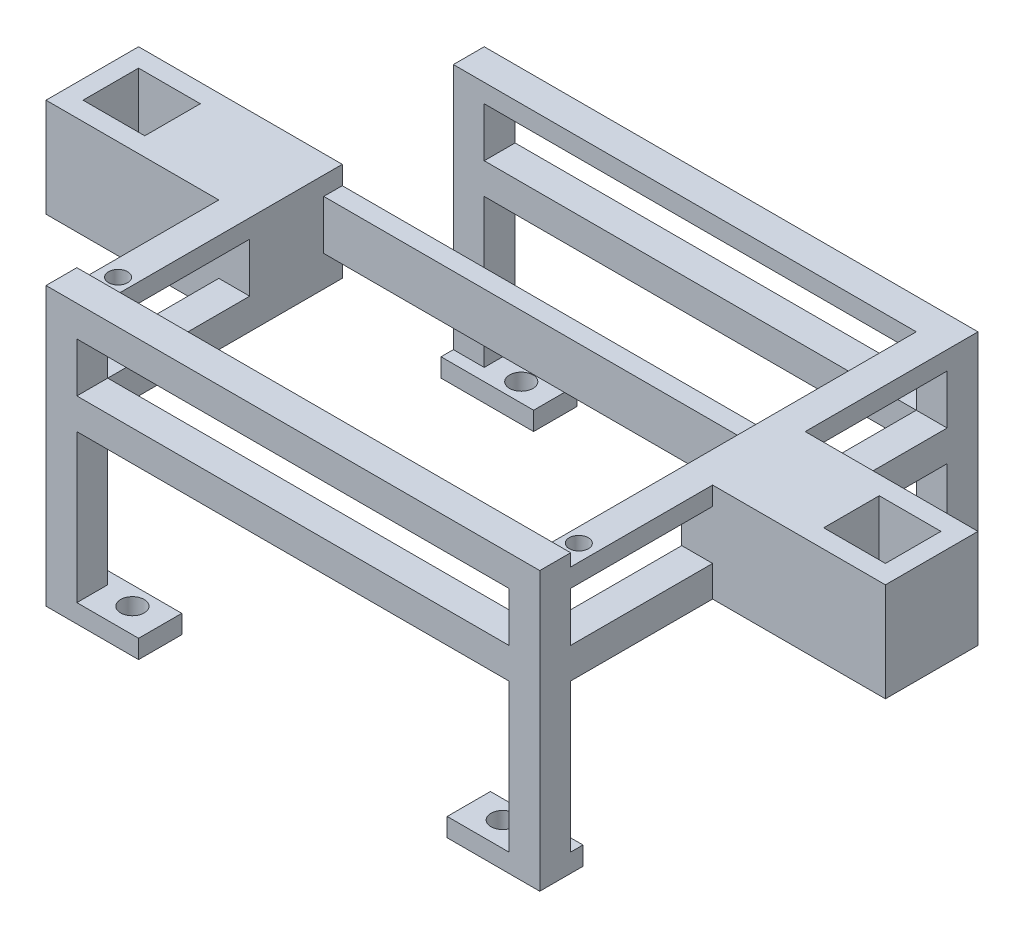
from build123d import *

# Parameters (mm, degrees)
SKETCH1_W             = 15
SKETCH1_H             = 7
SKETCH1_R             = 1.9
BOSS_EXTRUDE1_DEPTH   = 3
BOSS_EXTRUDE1_2_DEPTH = 3
BOSS_EXTRUDE1_3_DEPTH = 3
BOSS_EXTRUDE1_4_DEPTH = 3
SKETCH2_W             = 5
SKETCH2_H             = 5
BOSS_EXTRUDE2_DEPTH   = 37
SKETCH4_W             = 5
SKETCH4_H             = 61
BOSS_EXTRUDE3_DEPTH   = 3
BOSS_EXTRUDE3_2_DEPTH = 3
SKETCH5_W             = 80
SKETCH5_H             = 5
BOSS_EXTRUDE5_DEPTH   = 3
SKETCH6_W             = 80
SKETCH6_H             = 5
BOSS_EXTRUDE6_DEPTH   = 5
SKETCH7_R             = 1.55
CUT_EXTRUDE1_DEPTH    = 3
SKETCH8_W             = 70
SKETCH8_H             = 5
BOSS_EXTRUDE7_DEPTH   = 5
SKETCH9_W             = 61
SKETCH9_H             = 5
BOSS_EXTRUDE8_DEPTH   = 5
SKETCH13_W            = 33
SKETCH13_H            = 15
SKETCH13_W_2          = 10
SKETCH13_H_2          = 9
BOSS_EXTRUDE10_DEPTH  = 16
SKETCH14_W            = 3
SKETCH14_H            = 8
BOSS_EXTRUDE11_DEPTH  = 70
SKETCH15_W            = 5
SKETCH15_H            = 23
CUT_EXTRUDE4_DEPTH    = 16


with BuildPart() as part:
    # Sketch1 → Boss-Extrude1 (new body)
    with BuildSketch(Plane(origin=(0, 0, 0), x_dir=(1, 0, 0), z_dir=(0, 1, 0))):
        with Locations((32.5, 32)):
            Rectangle(SKETCH1_W, SKETCH1_H)
        with Locations(Location((30, 31.5, 0), (0, 0, 270))):
            Circle(SKETCH1_R, mode=Mode.SUBTRACT)
    extrude(amount=BOSS_EXTRUDE1_DEPTH)



with BuildPart() as body_2:
    # Sketch1 → Boss-Extrude1 2 (new body)
    with BuildSketch(Plane(origin=(0, 0, 0), x_dir=(1, 0, 0), z_dir=(0, 1, 0))):
        with Locations((32.5, -32)):
            Rectangle(SKETCH1_W, SKETCH1_H)
        with Locations(Location((30, -31.5, 0), (0, 0, 90))):
            Circle(SKETCH1_R, mode=Mode.SUBTRACT)
    extrude(amount=BOSS_EXTRUDE1_2_DEPTH)


with BuildPart() as body_3:
    # Sketch1 → Boss-Extrude1 3 (new body)
    with BuildSketch(Plane(origin=(0, 0, 0), x_dir=(1, 0, 0), z_dir=(0, 1, 0))):
        with Locations((-32.5, -32)):
            Rectangle(SKETCH1_W, SKETCH1_H)
        with Locations(Location((-30, -31.5, 0), (0, 0, 270))):
            Circle(SKETCH1_R, mode=Mode.SUBTRACT)
    extrude(amount=BOSS_EXTRUDE1_3_DEPTH)


with BuildPart() as body_4:
    # Sketch1 → Boss-Extrude1 4 (new body)
    with BuildSketch(Plane(origin=(0, 0, 0), x_dir=(1, 0, 0), z_dir=(0, 1, 0))):
        with Locations((-32.5, 32)):
            Rectangle(SKETCH1_W, SKETCH1_H)
        with Locations(Location((-30, 31.5, 0), (0, 0, 90))):
            Circle(SKETCH1_R, mode=Mode.SUBTRACT)
    extrude(amount=BOSS_EXTRUDE1_4_DEPTH)


with BuildPart() as part_1:
    add(part.part)

    add(body_2.part)  # Boss-Extrude2 merges body 2

    add(body_3.part)  # Boss-Extrude2 merges body 3

    add(body_4.part)  # Boss-Extrude2 merges body 4
    # Sketch2 → Boss-Extrude2 (add)
    with BuildSketch(Plane(origin=(0, 3, 0), x_dir=(1, 0, 0), z_dir=(0, 1, 0))):
        with Locations((37.5, 33)):
            Rectangle(SKETCH2_W, SKETCH2_H)
        with Locations((37.5, -33)):
            Rectangle(SKETCH2_W, SKETCH2_H)
        with Locations((-37.5, -33)):
            Rectangle(SKETCH2_W, SKETCH2_H)
        with Locations((-37.5, 33)):
            Rectangle(SKETCH2_W, SKETCH2_H)
    extrude(amount=BOSS_EXTRUDE2_DEPTH)



with BuildPart() as body_2_2:
    # Sketch4 → Boss-Extrude3 (new body)
    with BuildSketch(Plane(origin=(0, 40, 0), x_dir=(1, 0, 0), z_dir=(0, 1, 0))):
        with Locations((37.5, 0)):
            Rectangle(SKETCH4_W, SKETCH4_H)
    extrude(amount=BOSS_EXTRUDE3_DEPTH)


with BuildPart() as body_3_2:
    # Sketch4 → Boss-Extrude3 2 (new body)
    with BuildSketch(Plane(origin=(0, 40, 0), x_dir=(1, 0, 0), z_dir=(0, 1, 0))):
        with Locations((-37.5, 0)):
            Rectangle(SKETCH4_W, SKETCH4_H)
    extrude(amount=BOSS_EXTRUDE3_2_DEPTH)


with BuildPart() as part_2:
    add(part_1.part)

    add(body_2_2.part)  # Boss-Extrude5 merges body 2 2

    add(body_3_2.part)  # Boss-Extrude5 merges body 3 2
    # Sketch5 → Boss-Extrude5 (add)
    with BuildSketch(Plane(origin=(0, 40, 0), x_dir=(1, 0, 0), z_dir=(0, 1, 0))):
        with Locations((0, 33)):
            Rectangle(SKETCH5_W, SKETCH5_H)
    extrude(amount=BOSS_EXTRUDE5_DEPTH)

    # Sketch6 → Boss-Extrude6 (add)
    with BuildSketch(Plane(origin=(0, 40, 0), x_dir=(1, 0, 0), z_dir=(0, 1, 0))):
        with Locations((0, -33)):
            Rectangle(SKETCH6_W, SKETCH6_H)
    extrude(amount=BOSS_EXTRUDE6_DEPTH)

    # Sketch7 → Cut-Extrude1 (cut)
    with BuildSketch(Plane(origin=(0, 43, 0), x_dir=(1, 0, 0), z_dir=(0, 1, 0))):
        with Locations(Location((-37.325, -26.5, 0), (0, 0, 270))):
            Circle(SKETCH7_R)
        with Locations(Location((37.325, -26.5, 0), (0, 0, 270))):
            Circle(SKETCH7_R)
    extrude(amount=-CUT_EXTRUDE1_DEPTH, mode=Mode.SUBTRACT)

    # Sketch8 → Boss-Extrude7 (add)
    with BuildSketch(Plane.XY.offset(35.5)):
        with Locations((0, 29.5)):
            Rectangle(SKETCH8_W, SKETCH8_H)
    boss_extrude7 = extrude(amount=-BOSS_EXTRUDE7_DEPTH)

    # Mirror1: Boss-Extrude7 across plane
    add(boss_extrude7.mirror(Plane.XY))

    # Sketch9 → Boss-Extrude8 (add)
    with BuildSketch(Plane(origin=(40, 0, 0), x_dir=(0, 0, -1), z_dir=(1, 0, 0))):
        with Locations((0, 29.5)):
            Rectangle(SKETCH9_W, SKETCH9_H)
    boss_extrude8 = extrude(amount=-BOSS_EXTRUDE8_DEPTH)

    # Mirror2: Boss-Extrude8 across plane
    add(boss_extrude8.mirror(Plane(origin=(0, 0, 0), x_dir=(0, 0, 1), z_dir=(1, 0, 0))))

    # Sketch13 → Boss-Extrude10 (add)
    with BuildSketch(Plane(origin=(0, 43, 0), x_dir=(1, 0, 0), z_dir=(0, 1, 0))):
        with Locations((51.5, 0)):
            Rectangle(SKETCH13_W, SKETCH13_H)
        with Locations((60, 0)):
            Rectangle(SKETCH13_W_2, SKETCH13_H_2, mode=Mode.SUBTRACT)
    boss_extrude10 = extrude(amount=-BOSS_EXTRUDE10_DEPTH)

    # Mirror3: Boss-Extrude10 across plane
    add(boss_extrude10.mirror(Plane(origin=(0, 0, 0), x_dir=(0, 0, 1), z_dir=(1, 0, 0))))

    # Sketch14 → Boss-Extrude11 (add)
    with BuildSketch(Plane(origin=(-35, 0, 0), x_dir=(0, 0, -1), z_dir=(1, 0, 0))):
        with Locations((6, 36)):
            Rectangle(SKETCH14_W, SKETCH14_H)
    extrude(amount=BOSS_EXTRUDE11_DEPTH)

    # Sketch15 → Cut-Extrude4 (cut)
    with BuildSketch(Plane(origin=(0, 43, 0), x_dir=(1, 0, 0), z_dir=(0, 1, 0))):
        with Locations((-37.5, 19)):
            Rectangle(SKETCH15_W, SKETCH15_H)
    extrude(amount=-CUT_EXTRUDE4_DEPTH, mode=Mode.SUBTRACT)


solid = part_2.part
